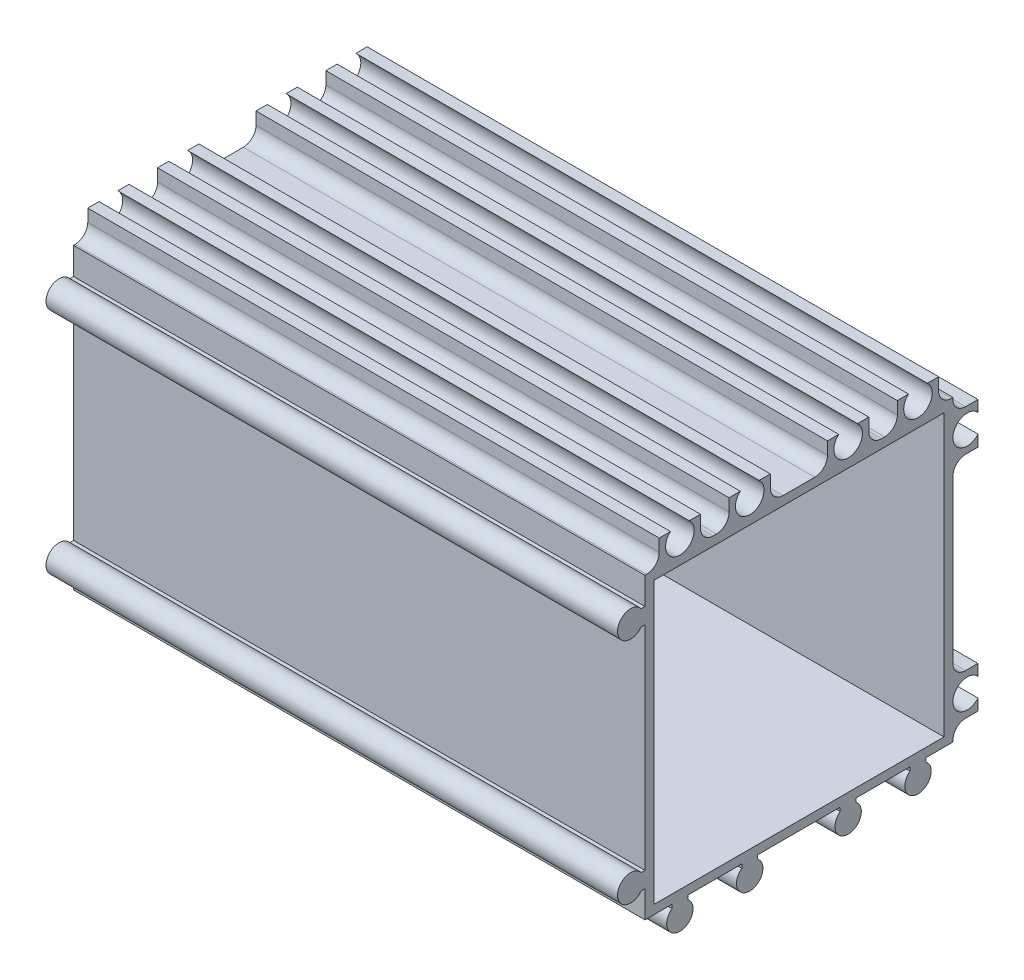
from build123d import *

# Parameters (mm, degrees)
EXTRUDE_1_DEPTH             = 90
SKETCH_2_W                  = 90
SKETCH_2_H                  = 42.75
EXTRUDE_2_DEPTH             = 8.2
SKETCH_3_W                  = 90
SKETCH_3_H                  = 52.45
EXTRUDE_3_DEPTH             = 8.2
SKETCH_4_W                  = 3.95
SKETCH_4_H                  = 2.25
CUT_EXTRUDE_1_DEPTH         = 235.487383722
SKETCH_5_W                  = 3.95
SKETCH_5_H                  = 29.5
CUT_EXTRUDE_2_DEPTH         = 235.487383722
SKETCH_6_W                  = 3.95
SKETCH_6_H                  = 6.2
CUT_EXTRUDE_3_DEPTH         = 235.487383722
SKETCH_7_W                  = 2.25
SKETCH_7_H                  = 3.95
CUT_EXTRUDE_4_DEPTH         = 235.487383722
SKETCH_8_W                  = 4.5
SKETCH_8_H                  = 3.95
CUT_EXTRUDE_5_DEPTH         = 235.487383722
SKETCH_9_W                  = 9
SKETCH_9_H                  = 3.95
CUT_EXTRUDE_6_DEPTH         = 235.487383722
SKETCH_10_W                 = 4.5
SKETCH_10_H                 = 3.95
CUT_EXTRUDE_7_DEPTH         = 235.487383722
SKETCH_11_W                 = 2.25
SKETCH_11_H                 = 3.95
CUT_EXTRUDE_8_DEPTH         = 235.487383722
SKETCH_12_W                 = 45.7
SKETCH_12_H                 = 44.2
CUT_EXTRUDE_9_DEPTH         = 86
HOLE_WIZARD_2_5_2_5_1_D     = 2.5
HOLE_WIZARD_4_5_4_5_1_D     = 4.5
HOLE_WIZARD_8_3_8_3_1_D     = 8.3
HOLE_WIZARD_8_3_8_3_1_DEPTH = 3.2
SKETCH_19_R                 = 1.67252853
SKETCH_19_R_2               = 1.459159852
SKETCH_19_R_3               = 1.459908976
SKETCH_19_R_4               = 1.592821911
SKETCH_19_R_5               = 1.532216665
SKETCH_19_R_6               = 1.596138091
EXTRUDE_4_DEPTH             = 90
CUT_EXTRUDE_START           = -90
SKETCH_20_R                 = 4.15
CUT_EXTRUDE_10_DEPTH        = 90
FILLET_1_R                  = 2
FILLET_2_R                  = 2
FILLET_3_R                  = 2
FILLET_4_R                  = 2
FILLET_5_R                  = 2
FILLET_6_R                  = 2
FILLET_7_R                  = 2
FILLET_8_R                  = 2
FILLET_9_R                  = 2
FILLET_10_R                 = 2
FILLET_11_R                 = 2
FILLET_12_R                 = 2
FILLET_13_R                 = 1.2


with BuildPart() as part:
    # Эскиз1 → Бобышка-Вытянуть1 (new body)
    with BuildSketch(Plane(origin=(90, 0, 0), x_dir=(0, 0, -1), z_dir=(1, 0, 0))):
        with BuildLine():
            Line((6.75, 160.906238208), (6.75, 204.25))
            Line((6.75, 204.25), (-38.093761792, 204.25))
            ThreePointArc((-38.093761792, 204.25), (-41.825, 203), (-38.093761792, 201.75))
            Line((-38.093761792, 201.75), (-37.5, 201.75))
            Line((-37.5, 201.75), (-37.5, 168.25))
            Line((-37.5, 168.25), (-38.093761792, 168.25))
            ThreePointArc((-38.093761792, 168.25), (-41.825, 167), (-38.093761792, 165.75))
            Line((-38.093761792, 165.75), (-37.5, 165.75))
            Line((-37.5, 165.75), (-37.5, 161.5))
            Line((-37.5, 161.5), (-33.25, 161.5))
            Line((-33.25, 161.5), (-33.25, 160.906238208))
            ThreePointArc((-33.25, 160.906238208), (-32, 157.175), (-30.75, 160.906238208))
            Line((-30.75, 160.906238208), (-30.75, 161.5))
            Line((-30.75, 161.5), (-22.25, 161.5))
            Line((-22.25, 161.5), (-22.25, 160.906238208))
            ThreePointArc((-22.25, 160.906238208), (-21, 157.175), (-19.75, 160.906238208))
            Line((-19.75, 160.906238208), (-19.75, 161.5))
            Line((-19.75, 161.5), (-6.75, 161.5))
            Line((-6.75, 161.5), (-6.75, 160.906238208))
            ThreePointArc((-6.75, 160.906238208), (-5.5, 157.175), (-4.25, 160.906238208))
            Line((-4.25, 160.906238208), (-4.25, 161.5))
            Line((-4.25, 161.5), (4.25, 161.5))
            Line((4.25, 161.5), (4.25, 160.906238208))
            ThreePointArc((4.25, 160.906238208), (5.5, 157.175), (6.75, 160.906238208))
        make_face()
    extrude(amount=-EXTRUDE_1_DEPTH)

    # Эскиз2 → Бобышка-Вытянуть2 (add)
    with BuildSketch(Plane(origin=(0, 0, -6.75), x_dir=(-1, 0, 0), z_dir=(0, 0, -1))):
        with Locations((-45, 182.875)):
            Rectangle(SKETCH_2_W, SKETCH_2_H)
    extrude(amount=EXTRUDE_2_DEPTH)

    # Эскиз3 → Бобышка-Вытянуть3 (add)
    with BuildSketch(Plane(origin=(0, 204.25, 0), x_dir=(-1, 0, 0), z_dir=(0, 1, 0))):
        with Locations((-45, 11.275)):
            Rectangle(SKETCH_3_W, SKETCH_3_H)
    extrude(amount=EXTRUDE_3_DEPTH)

    # Эскиз4 → Вырез-Вытянуть1 (cut, through all)
    with BuildSketch(Plane.ZY):
        with Locations((-12.975, 162.625)):
            Rectangle(SKETCH_4_W, SKETCH_4_H)
    extrude(amount=-CUT_EXTRUDE_1_DEPTH, mode=Mode.SUBTRACT)

    # Эскиз5 → Вырез-Вытянуть2 (cut, through all)
    with BuildSketch(Plane.ZY):
        with Locations((-12.975, 185)):
            Rectangle(SKETCH_5_W, SKETCH_5_H)
    extrude(amount=-CUT_EXTRUDE_2_DEPTH, mode=Mode.SUBTRACT)

    # Эскиз6 → Вырез-Вытянуть3 (cut, through all)
    with BuildSketch(Plane.ZY):
        with Locations((-12.975, 209.35)):
            Rectangle(SKETCH_6_W, SKETCH_6_H)
    extrude(amount=-CUT_EXTRUDE_3_DEPTH, mode=Mode.SUBTRACT)

    # Эскиз7 → Вырез-Вытянуть4 (cut, through all)
    with BuildSketch(Plane.ZY):
        with Locations((-9.875, 210.475)):
            Rectangle(SKETCH_7_W, SKETCH_7_H)
    extrude(amount=-CUT_EXTRUDE_4_DEPTH, mode=Mode.SUBTRACT)

    # Эскиз8 → Вырез-Вытянуть5 (cut, through all)
    with BuildSketch(Plane.ZY):
        with Locations((0, 210.475)):
            Rectangle(SKETCH_8_W, SKETCH_8_H)
    extrude(amount=-CUT_EXTRUDE_5_DEPTH, mode=Mode.SUBTRACT)

    # Эскиз9 → Вырез-Вытянуть6 (cut, through all)
    with BuildSketch(Plane.ZY):
        with Locations((13.25, 210.475)):
            Rectangle(SKETCH_9_W, SKETCH_9_H)
    extrude(amount=-CUT_EXTRUDE_6_DEPTH, mode=Mode.SUBTRACT)

    # Эскиз10 → Вырез-Вытянуть7 (cut, through all)
    with BuildSketch(Plane.ZY):
        with Locations((26.5, 210.475)):
            Rectangle(SKETCH_10_W, SKETCH_10_H)
    extrude(amount=-CUT_EXTRUDE_7_DEPTH, mode=Mode.SUBTRACT)

    # Эскиз11 → Вырез-Вытянуть8 (cut, through all)
    with BuildSketch(Plane.ZY):
        with Locations((36.375, 210.475)):
            Rectangle(SKETCH_11_W, SKETCH_11_H)
    extrude(amount=-CUT_EXTRUDE_8_DEPTH, mode=Mode.SUBTRACT)

    # Эскиз12 → Вырез-Вытянуть9 (cut)
    with BuildSketch(Plane(origin=(90, 0, 0), x_dir=(0, 0, -1), z_dir=(1, 0, 0))):
        with Locations((-13.25, 185)):
            Rectangle(SKETCH_12_W, SKETCH_12_H)
    extrude(amount=-CUT_EXTRUDE_9_DEPTH, mode=Mode.SUBTRACT)

    # Диаметр отверстия Ø2.5 (2.5)1 (through all)
    with Locations(Plane(origin=(90, 0, 0), x_dir=(0, 0, -1), z_dir=(1, 0, 0))):
        with Locations((5.5, 159.25), (-21, 159.25), (-5.5, 159.25), (-32, 159.25), (-39.75, 167), (-39.75, 203)):
            Hole(HOLE_WIZARD_2_5_2_5_1_D / 2)

    # Диаметр отверстия Ø4.5 (4.5)1 (through all)
    with Locations(Plane.ZY):
        with Locations((-13.25, 167), (-13.25, 203), (-5.5, 210.75), (5.5, 210.75), (21, 210.75), (32, 210.75)):
            Hole(HOLE_WIZARD_4_5_4_5_1_D / 2)

    # Диаметр отверстия Ø8.3 (8.3)1
    with Locations(Plane.ZY):
        with Locations((13.25, 185)):
            Hole(HOLE_WIZARD_8_3_8_3_1_D / 2, depth=HOLE_WIZARD_8_3_8_3_1_DEPTH)

    # Эскиз19 → Бобышка-Вытянуть4 (add)
    with BuildSketch(Plane(origin=(90, 0, 0), x_dir=(0, 0, -1), z_dir=(1, 0, 0))):
        with Locations((-39.75, 203)):
            Circle(SKETCH_19_R)
        with Locations((-39.75, 167)):
            Circle(SKETCH_19_R_2)
        with Locations((-32, 159.25)):
            Circle(SKETCH_19_R_3)
        with Locations((-21, 159.25)):
            Circle(SKETCH_19_R_4)
        with Locations((-5.5, 159.25)):
            Circle(SKETCH_19_R_5)
        with Locations((5.5, 159.25)):
            Circle(SKETCH_19_R_6)
    extrude(amount=-EXTRUDE_4_DEPTH)

    # Эскиз20 → Вырез-Вытянуть10 (cut)
    with BuildSketch(Plane.ZY.offset(CUT_EXTRUDE_START)):
        with Locations((13.25, 185)):
            Circle(SKETCH_20_R)
    extrude(amount=CUT_EXTRUDE_10_DEPTH, mode=Mode.SUBTRACT)

    # Скругление1
    fillet_1_edges = [part.edges().sort_by_distance(p)[0] for p in [
        (45, 208.5, -8.75),
    ]]
    fillet(fillet_1_edges, radius=FILLET_1_R)

    # Скругление2
    fillet_2_edges = [part.edges().sort_by_distance(p)[0] for p in [
        (45, 163.75, -11),
    ]]
    fillet(fillet_2_edges, radius=FILLET_2_R)

    # Скругление3
    fillet_3_edges = [part.edges().sort_by_distance(p)[0] for p in [
        (45, 170.25, -11),
    ]]
    fillet(fillet_3_edges, radius=FILLET_3_R)

    # Скругление4
    fillet_4_edges = [part.edges().sort_by_distance(p)[0] for p in [
        (45, 199.75, -11),
    ]]
    fillet(fillet_4_edges, radius=FILLET_4_R)

    # Скругление5
    fillet_5_edges = [part.edges().sort_by_distance(p)[0] for p in [
        (45, 206.25, -11),
    ]]
    fillet(fillet_5_edges, radius=FILLET_5_R)

    # Скругление6
    fillet_6_edges = [part.edges().sort_by_distance(p)[0] for p in [
        (45, 208.5, -2.25),
    ]]
    fillet(fillet_6_edges, radius=FILLET_6_R)

    # Скругление7
    fillet_7_edges = [part.edges().sort_by_distance(p)[0] for p in [
        (45, 208.5, 2.25),
    ]]
    fillet(fillet_7_edges, radius=FILLET_7_R)

    # Скругление8
    fillet_8_edges = [part.edges().sort_by_distance(p)[0] for p in [
        (45, 208.5, 8.75),
    ]]
    fillet(fillet_8_edges, radius=FILLET_8_R)

    # Скругление9
    fillet_9_edges = [part.edges().sort_by_distance(p)[0] for p in [
        (45, 208.5, 17.75),
    ]]
    fillet(fillet_9_edges, radius=FILLET_9_R)

    # Скругление10
    fillet_10_edges = [part.edges().sort_by_distance(p)[0] for p in [
        (45, 208.5, 24.25),
    ]]
    fillet(fillet_10_edges, radius=FILLET_10_R)

    # Скругление11
    fillet_11_edges = [part.edges().sort_by_distance(p)[0] for p in [
        (45, 208.5, 28.75),
    ]]
    fillet(fillet_11_edges, radius=FILLET_11_R)

    # Скругление12
    fillet_12_edges = [part.edges().sort_by_distance(p)[0] for p in [
        (45, 208.5, 35.25),
    ]]
    fillet(fillet_12_edges, radius=FILLET_12_R)

    # Скругление13
    fillet_13_edges = [part.edges().sort_by_distance(p)[0] for p in [
        (4, 185, -9.6),
        (4, 162.9, 13.25),
        (4, 185, 36.1),
        (4, 207.1, 13.25),
    ]]
    fillet(fillet_13_edges, radius=FILLET_13_R)


solid = part.part
